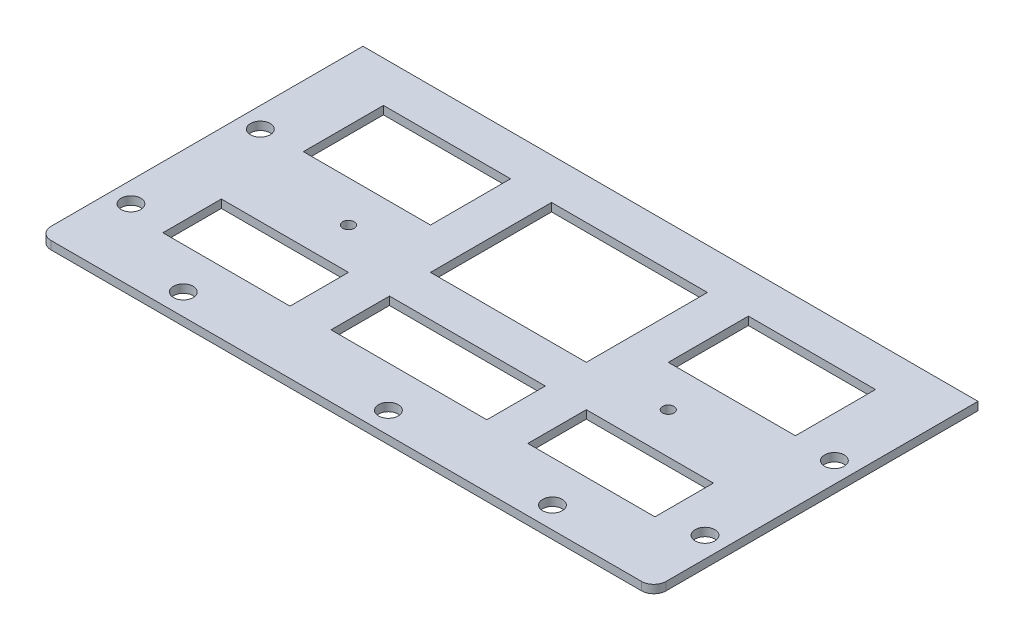
from build123d import *

# Parameters (mm, degrees)
ESQUISSE1_W        = 150
ESQUISSE1_H        = 79.06
ESQUISSE1_R        = 2.4
ESQUISSE1_R_2      = 1.4
ESQUISSE1_W_2      = 31
ESQUISSE1_H_2      = 19.53
ESQUISSE1_W_3      = 38
ESQUISSE1_H_3      = 29.53
ESQUISSE1_H_4      = 14.26
BOSS_EXTRU_1_DEPTH = 2
CONG_1_R           = 3


with BuildPart() as part:
    # Esquisse1 → Boss.-Extru.1 (new body)
    with BuildSketch(Plane(origin=(0, 0, 0), x_dir=(1, 0, 0), z_dir=(0, 1, 0))):
        with Locations((75, 39.53)):
            Rectangle(ESQUISSE1_W, ESQUISSE1_H)
        with Locations(Location((5, 49.04, 0), (0, 0, 270))):
            Circle(ESQUISSE1_R, mode=Mode.SUBTRACT)
        with Locations(Location((5, 17.48, 0), (0, 0, 270))):
            Circle(ESQUISSE1_R, mode=Mode.SUBTRACT)
        with Locations(Location((29.99, 5.27, 0), (0, 0, 270))):
            Circle(ESQUISSE1_R, mode=Mode.SUBTRACT)
        with Locations(Location((80, 5.27, 0), (0, 0, 270))):
            Circle(ESQUISSE1_R, mode=Mode.SUBTRACT)
        with Locations(Location((120.01, 5.27, 0), (0, 0, 270))):
            Circle(ESQUISSE1_R, mode=Mode.SUBTRACT)
        with Locations(Location((145, 49.04, 0), (0, 0, 270))):
            Circle(ESQUISSE1_R, mode=Mode.SUBTRACT)
        with Locations(Location((145, 17.48, 0), (0, 0, 270))):
            Circle(ESQUISSE1_R, mode=Mode.SUBTRACT)
        with Locations(Location((36, 39.53, 0), (0, 0, 270))):
            Circle(ESQUISSE1_R_2, mode=Mode.SUBTRACT)
        with Locations(Location((114, 39.53, 0), (0, 0, 270))):
            Circle(ESQUISSE1_R_2, mode=Mode.SUBTRACT)
        with Locations((30.5, 59.295)):
            Rectangle(ESQUISSE1_W_2, ESQUISSE1_H_2, mode=Mode.SUBTRACT)
        with Locations((75, 54.295)):
            Rectangle(ESQUISSE1_W_3, ESQUISSE1_H_3, mode=Mode.SUBTRACT)
        with Locations((119.5, 59.295)):
            Rectangle(ESQUISSE1_W_2, ESQUISSE1_H_2, mode=Mode.SUBTRACT)
        with Locations((119.5, 22.4)):
            Rectangle(ESQUISSE1_W_2, ESQUISSE1_H_4, mode=Mode.SUBTRACT)
        with Locations((75, 22.4)):
            Rectangle(ESQUISSE1_W_3, ESQUISSE1_H_4, mode=Mode.SUBTRACT)
        with Locations((30.5, 22.4)):
            Rectangle(ESQUISSE1_W_2, ESQUISSE1_H_4, mode=Mode.SUBTRACT)
    extrude(amount=BOSS_EXTRU_1_DEPTH)

    # Congé1
    cong_1_edges = [part.edges().sort_by_distance(p)[0] for p in [
        (150, 1, 0),
        (0, 1, 0),
    ]]
    fillet(cong_1_edges, radius=CONG_1_R)


solid = part.part
